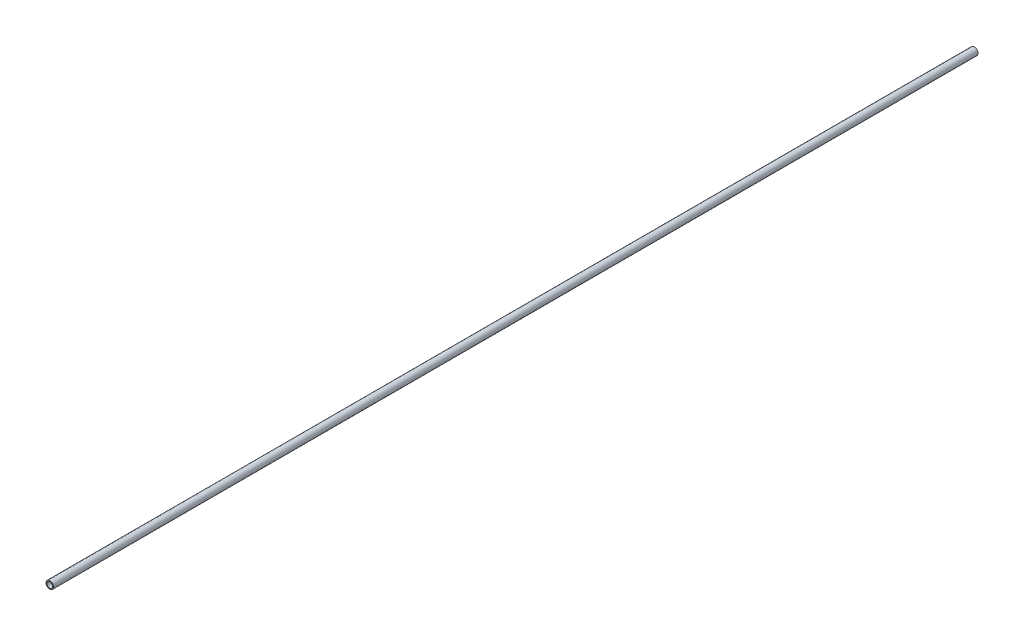
from build123d import *

# Parameters (mm, degrees)
SKETCH1_R           = 4
SKETCH1_R_2         = 3
BOSS_EXTRUDE1_DEPTH = 990.6


with BuildPart() as part:
    # Sketch1 → Boss-Extrude1 (new body)
    with BuildSketch(Plane.XY):
        with Locations(Location((0, 0, 0), (0, 0, 180))):
            Circle(SKETCH1_R)
        with Locations(Location((0, 0, 0), (0, 0, 180))):
            Circle(SKETCH1_R_2, mode=Mode.SUBTRACT)
    extrude(amount=BOSS_EXTRUDE1_DEPTH)


solid = part.part
